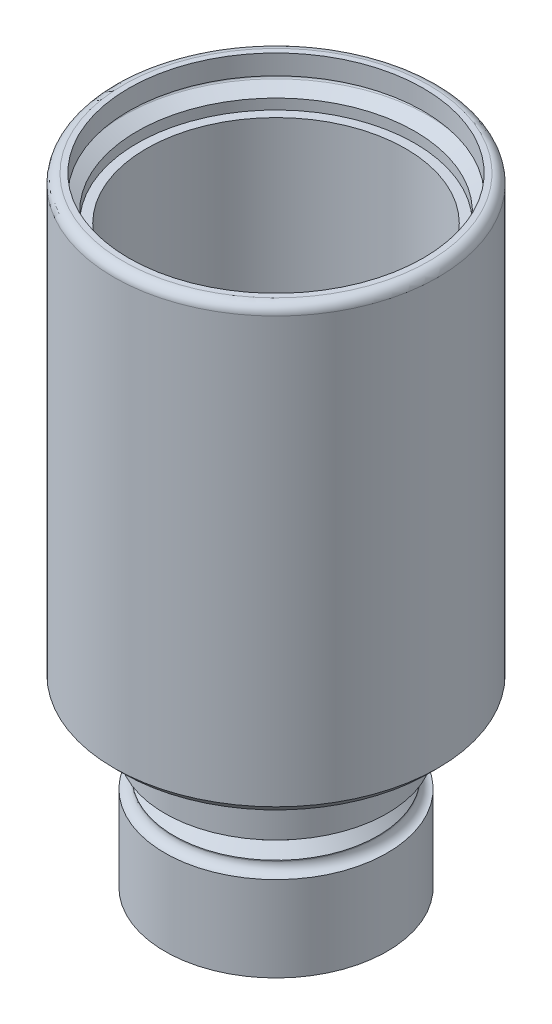
from build123d import *

# Parameters (mm, degrees)
CHAMFER_1_SIZE = 1
FILLET_1_R     = 0.5
FILLET_2_R     = 0.2
FILLET_3_R     = 0.4
FILLET_4_R     = 0.2
FILLET_5_R     = 1


with BuildPart() as part:
    # Эскиз1 → Повернуть1 (revolve)
    with BuildSketch(Plane.XY, mode=Mode.PRIVATE) as revolve_1_sk:
        with BuildLine():
            Line((-15.9, 66.8), (-17.5, 66.8))
            Line((-17.5, 66.8), (-17.5, 18.9))
            Line((-17.5, 18.9), (-13.000918144, 18.9))
            Line((-13.000918144, 18.9), (-12, 16.15))
            Line((-12, 16.15), (-12, 12.9))
            Line((-12, 12.9), (-9.9, 12.9))
            Line((-9.9, 12.9), (-9.9, 11.4))
            Line((-9.9, 11.4), (-11, 10.3))
            Line((-11, 10.3), (-11, 10.2))
            ThreePointArc((-11, 10.2), (-11.292893219, 9.492893219), (-12, 9.2))
            Line((-12, 9.2), (-12, 0))
            Line((-12, 0), (-7.5, 0))
            Line((-7.5, 0), (-7.5, 1.8))
            Line((-7.5, 1.8), (-9.75, 1.8))
            Line((-9.75, 1.8), (-9.75, 4.8))
            Line((-9.75, 4.8), (-7.5, 4.8))
            Line((-7.5, 4.8), (-7.5, 6.3))
            Line((-7.5, 6.3), (-9.75, 6.3))
            Line((-9.75, 6.3), (-9.75, 9.3))
            Line((-9.75, 9.3), (-7.5, 9.3))
            Line((-7.5, 9.3), (-7.5, 10.4))
            Line((-7.5, 10.4), (-7, 10.4))
            Line((-7, 10.4), (-7, 11.1))
            ThreePointArc((-7, 11.1), (-7.6, 11.7), (-7, 12.3))
            Line((-7, 12.3), (-7, 15.4))
            Line((-7, 15.4), (-6, 15.4))
            Line((-6, 15.4), (-6, 17.462177826))
            Line((-6, 17.462177826), (-9.5, 18.4))
            Line((-9.5, 18.4), (-9.5, 32.053589838))
            Line((-9.5, 32.053589838), (-10.1, 32.4))
            Line((-10.1, 32.4), (-10.1, 33.6))
            Line((-10.1, 33.6), (-9.5, 33.6))
            Line((-9.5, 33.6), (-9.5, 35.299930358))
            Line((-9.5, 35.299930358), (-11, 41.1))
            Line((-11, 41.1), (-14, 41.1))
            Line((-14, 41.1), (-14, 62.1))
            Line((-14, 62.1), (-15, 62.1))
            Line((-15, 62.1), (-15, 63.218504542))
            Line((-15, 63.218504542), (-16.4, 64.026794919))
            ThreePointArc((-16.4, 64.026794919), (-16.5, 64.2), (-16.4, 64.373205081))
            Line((-16.4, 64.373205081), (-15.9, 64.661880215))
            Line((-15.9, 64.661880215), (-15.9, 66.8))
        make_face()
    revolve(revolve_1_sk.sketch.rotate(Axis((0, 0, 0), (0, 1, 0)), 270), axis=Axis((0, 0, 0), (0, 1, 0)))

    # Фаска1
    chamfer_1_edges = [part.edges().sort_by_distance(p)[0] for p in [
        (0, 18.9, 17.5),
    ]]
    chamfer(chamfer_1_edges, length=CHAMFER_1_SIZE)

    # Скругление1
    fillet_1_edges = [part.edges().sort_by_distance(p)[0] for p in [
        (0, 0, 7.5),
    ]]
    fillet(fillet_1_edges, radius=FILLET_1_R)

    # Скругление2
    fillet_2_edges = [part.edges().sort_by_distance(p)[0] for p in [
        (0, 1.8, 7.5),
        (0, 9.3, 7.5),
        (0, 6.3, 7.5),
        (0, 4.8, 7.5),
    ]]
    fillet(fillet_2_edges, radius=FILLET_2_R)

    # Скругление3
    fillet_3_edges = [part.edges().sort_by_distance(p)[0] for p in [
        (0, 4.8, 9.75),
        (0, 1.8, 9.75),
        (0, 9.3, 9.75),
        (0, 6.3, 9.75),
    ]]
    fillet(fillet_3_edges, radius=FILLET_3_R)

    # Скругление4
    fillet_4_edges = [part.edges().sort_by_distance(p)[0] for p in [
        (0, 41.1, 11),
        (0, 35.299930358, 9.5),
        (0, 33.6, 9.5),
        (0, 33.6, 10.1),
        (0, 32.4, 10.1),
        (0, 32.053589838, 9.5),
    ]]
    fillet(fillet_4_edges, radius=FILLET_4_R)

    # Скругление5
    fillet_5_edges = [part.edges().sort_by_distance(p)[0] for p in [
        (0, 66.8, 17.5),
    ]]
    fillet(fillet_5_edges, radius=FILLET_5_R)


solid = part.part
